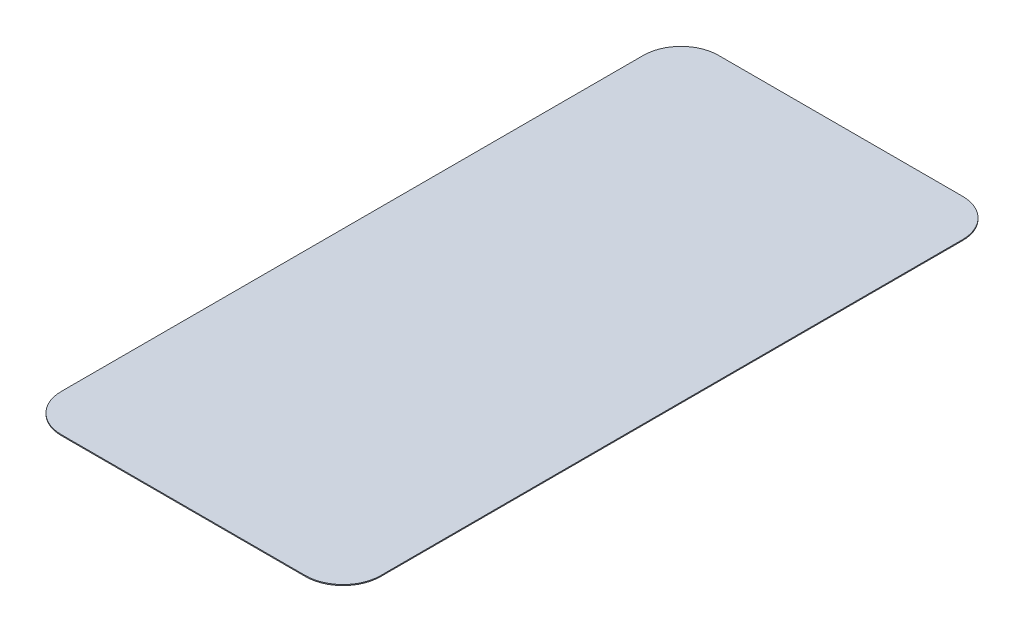
from build123d import *

# Parameters (mm, degrees)
BOSS_EXTRUDE1_DEPTH = 0.5


with BuildPart() as part:
    # Sketch1 → Boss-Extrude1 (new body)
    with BuildSketch(Plane(origin=(0, 0, 0), x_dir=(1, 0, 0), z_dir=(0, 1, 0))):
        with BuildLine():
            Line((-65, 175), (65, 175))
            ThreePointArc((65, 175), (79.142135624, 169.142135624), (85, 155))
            Line((85, 155), (85, -155))
            ThreePointArc((85, -155), (79.142135624, -169.142135624), (65, -175))
            Line((65, -175), (-65, -175))
            ThreePointArc((-65, -175), (-79.142135624, -169.142135624), (-85, -155))
            Line((-85, -155), (-85, 155))
            ThreePointArc((-85, 155), (-79.142135624, 169.142135624), (-65, 175))
        make_face()
    extrude(amount=BOSS_EXTRUDE1_DEPTH)


solid = part.part
